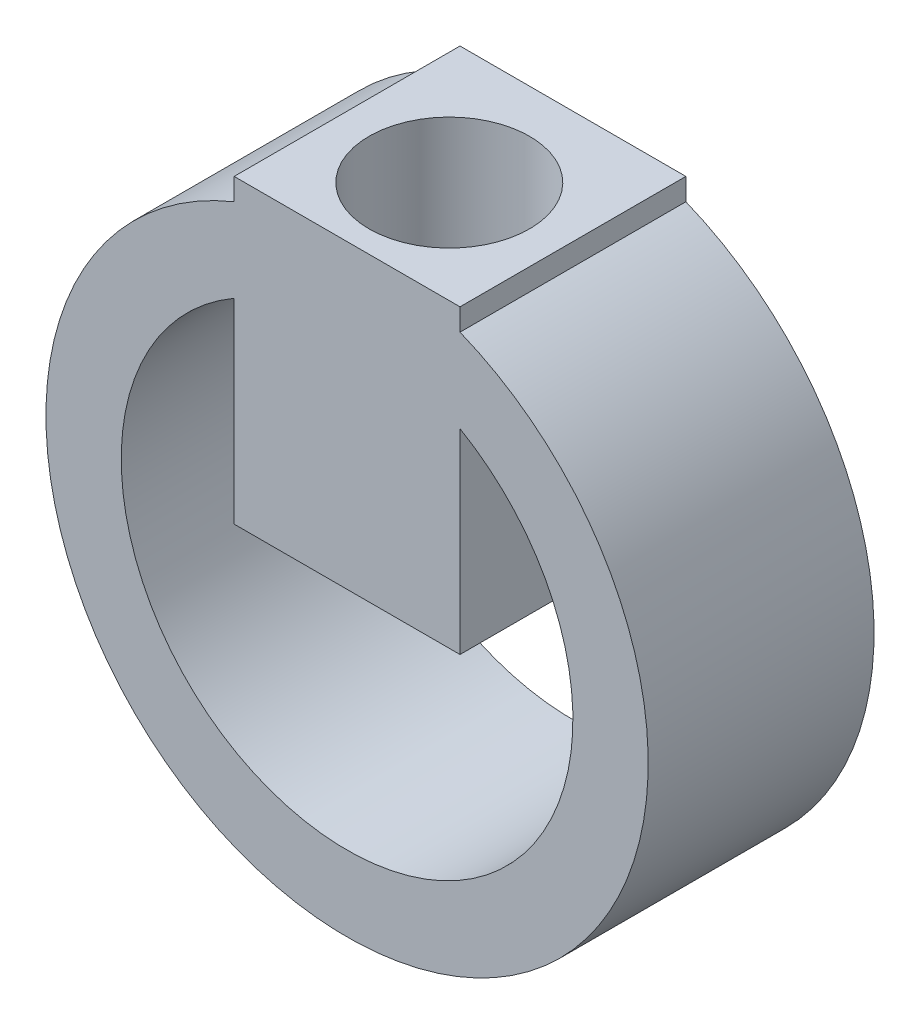
from build123d import *

# Parameters (mm, degrees)
SKETCH2_R               = 25.4
BOSS_EXTRUDE1_DEPTH     = 19.05
CUT_EXTRUDE1_DEPTH      = 41.659838908
CUT_EXTRUDE1_DEPTH_BACK = 41.659838908
SKETCH3_R               = 19.05
SKETCH4_W               = 19.05
SKETCH4_H               = 19.05
BOSS_EXTRUDE2_DEPTH     = 25.4
SKETCH7_R               = 6.769739398
CUT_EXTRUDE2_DEPTH      = 41.659838908


with BuildPart() as part:
    # Sketch2 → Boss-Extrude1 (new body)
    with BuildSketch(Plane.XY):
        with Locations(Location((0, 0, 0), (0, 0, 180))):
            Circle(SKETCH2_R)
    extrude(amount=BOSS_EXTRUDE1_DEPTH)

    # Sketch3 → Cut-Extrude1 (cut, two sides: drawn at the far end of the back side and taken through both)
    with BuildSketch(Plane.XY.offset(19.05).offset(-CUT_EXTRUDE1_DEPTH_BACK)):
        Circle(SKETCH3_R)
    extrude(amount=CUT_EXTRUDE1_DEPTH + CUT_EXTRUDE1_DEPTH_BACK, mode=Mode.SUBTRACT)

    # Sketch4 → Boss-Extrude2 (add)
    with BuildSketch(Plane(origin=(0, 0, 0), x_dir=(1, 0, 0), z_dir=(0, 1, 0))):
        with Locations((0, -9.525)):
            Rectangle(SKETCH4_W, SKETCH4_H)
    extrude(amount=BOSS_EXTRUDE2_DEPTH)

    # Sketch7 → Cut-Extrude2 (cut, through all)
    with BuildSketch(Plane(origin=(0, 0, 0), x_dir=(1, 0, 0), z_dir=(0, 1, 0))):
        with Locations(Location((0, -10.42763192, 0), (0, 0, 270))):
            Circle(SKETCH7_R)
    extrude(amount=CUT_EXTRUDE2_DEPTH, mode=Mode.SUBTRACT)


solid = part.part
